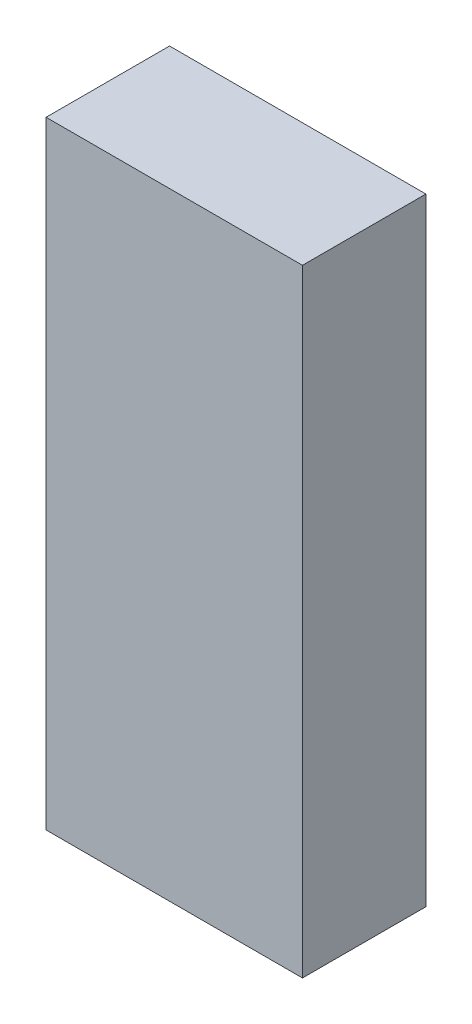
from build123d import *

# Parameters (mm, degrees)
ESQUISSE1_W        = 27
ESQUISSE1_H        = 65
BOSS_EXTRU_1_DEPTH = 6.5


with BuildPart() as part:
    # Esquisse1 → Boss.-Extru.1 (new, symmetric)
    with BuildSketch(Plane.XY):
        Rectangle(ESQUISSE1_W, ESQUISSE1_H)
    extrude(amount=BOSS_EXTRU_1_DEPTH, both=True)


solid = part.part
